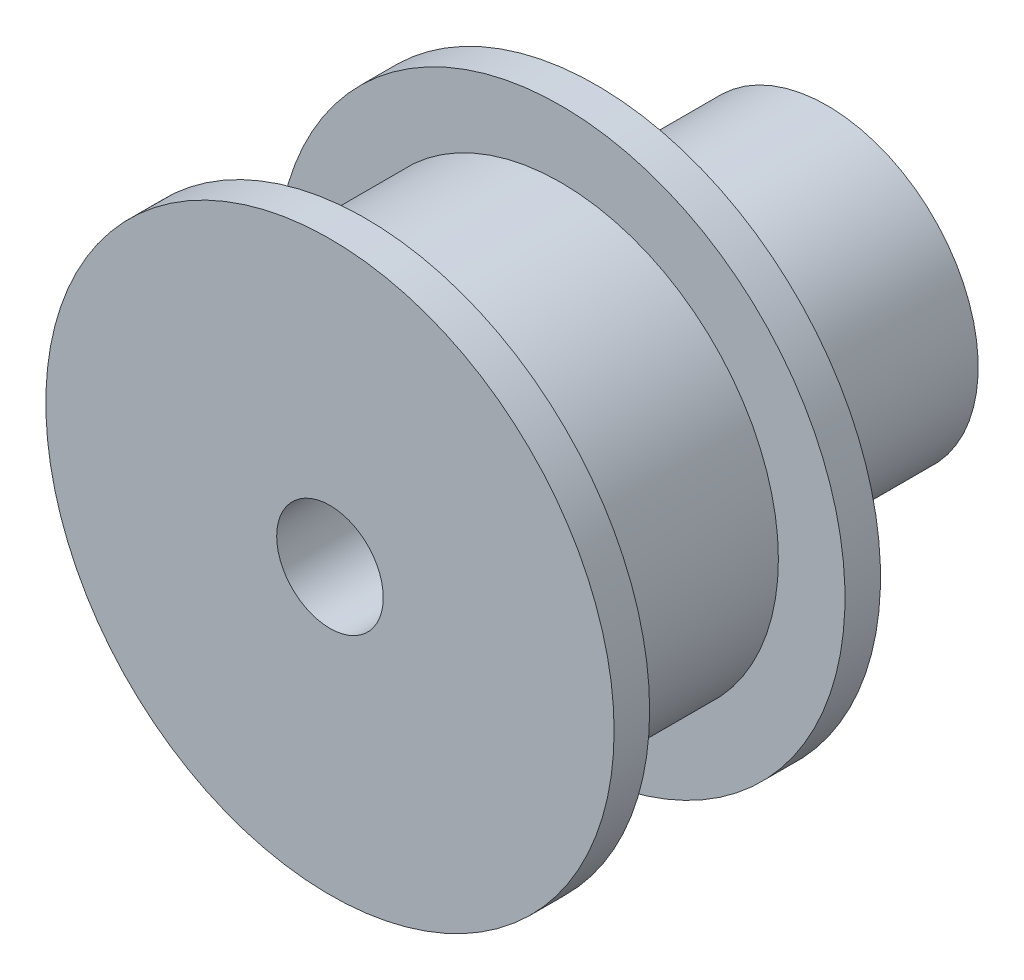
from build123d import *

# Parameters (mm, degrees)
SKETCH1_R           = 12.25
BOSS_EXTRUDE1_DEPTH = 11
SKETCH2_R           = 16
BOSS_EXTRUDE2_DEPTH = 2
SKETCH4_R           = 10
BOSS_EXTRUDE4_DEPTH = 1
SKETCH5_R           = 8.5
BOSS_EXTRUDE5_DEPTH = 12
SKETCH6_R           = 3
CUT_EXTRUDE1_DEPTH  = 100
CHAMFER1_SIZE       = 1
BOSS_EXTRUDE6_START = 2
SKETCH3_R           = 16
BOSS_EXTRUDE6_DEPTH = 2
CUT_EXTRUDE2_START  = -10
SKETCH7_R           = 3
CUT_EXTRUDE2_DEPTH  = 10


with BuildPart() as part:
    # Sketch1 → Boss-Extrude1 (new body)
    with BuildSketch(Plane.XY):
        Circle(SKETCH1_R)
    extrude(amount=BOSS_EXTRUDE1_DEPTH)

    # Sketch2 → Boss-Extrude2 (add)
    with BuildSketch(Plane(origin=(0, 0, 0), x_dir=(-1, 0, 0), z_dir=(0, 0, -1))):
        Circle(SKETCH2_R)
    extrude(amount=BOSS_EXTRUDE2_DEPTH)

    # Sketch4 → Boss-Extrude4 (add)
    with BuildSketch(Plane(origin=(0, 0, -2), x_dir=(-1, 0, 0), z_dir=(0, 0, -1))):
        Circle(SKETCH4_R)
    extrude(amount=BOSS_EXTRUDE4_DEPTH)

    # Sketch5 → Boss-Extrude5 (add)
    with BuildSketch(Plane(origin=(0, 0, -3), x_dir=(-1, 0, 0), z_dir=(0, 0, -1))):
        Circle(SKETCH5_R)
    extrude(amount=BOSS_EXTRUDE5_DEPTH)

    # Sketch6 → Cut-Extrude1 (cut)
    with BuildSketch(Plane(origin=(0, 0, -15), x_dir=(-1, 0, 0), z_dir=(0, 0, -1))):
        Circle(SKETCH6_R)
    extrude(amount=-CUT_EXTRUDE1_DEPTH, mode=Mode.SUBTRACT)

    # Chamfer1
    chamfer1_edges = [part.edges().sort_by_distance(p)[0] for p in [
        (3, 0, -15),
    ]]
    chamfer(chamfer1_edges, length=CHAMFER1_SIZE)

    # Sketch3 → Boss-Extrude6 (add)
    with BuildSketch(Plane.XY.offset(11).offset(BOSS_EXTRUDE6_START)):
        with Locations(Location((0, 0, 0), (0, 0, 180))):
            Circle(SKETCH3_R)
    extrude(amount=-BOSS_EXTRUDE6_DEPTH)

    # Sketch7 → Cut-Extrude2 (cut)
    with BuildSketch(Plane.XY.offset(13).offset(CUT_EXTRUDE2_START)):
        with Locations(Location((0, 0, 0), (0, 0, 180))):
            Circle(SKETCH7_R)
    extrude(amount=CUT_EXTRUDE2_DEPTH, mode=Mode.SUBTRACT)


solid = part.part
